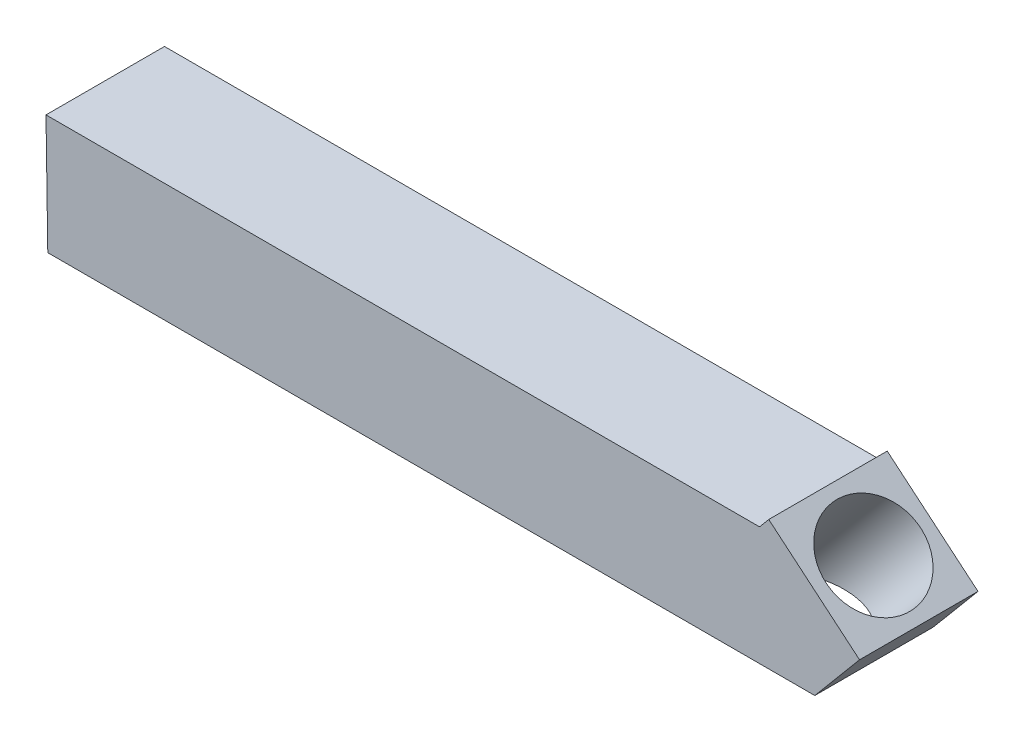
from build123d import *

# Parameters (mm, degrees)
BOSS_EXTRUDE1_DEPTH = 2.5
SKETCH2_R           = 1
CUT_EXTRUDE1_DEPTH  = 4.5
SKETCH3_R           = 1
CUT_EXTRUDE2_DEPTH  = 9.5
SKETCH5_R           = 1
BOSS_EXTRUDE2_DEPTH = 9.5


with BuildPart() as part:
    # Sketch1 → Boss-Extrude1 (new body)
    with BuildSketch(Plane.XY):
        Polygon((-70.406172668, -77.710060133), (-55.350496572, -77.710060133), (-55.155758053, -77.477979804), (-53.240646945, -79.084948828), (-54.184487309, -80.209773972), (-70.368347793, -80.209773972), align=None)
    extrude(amount=BOSS_EXTRUDE1_DEPTH)

    # Sketch2 → Cut-Extrude1 (cut)
    with BuildSketch(Plane(origin=(-60.939488189, -72.62485398, 0), x_dir=(0, 0, -1), z_dir=(0.6427876096865354, 0.7660444431189815, 0))):
        with Locations(Location((-1.25, -8.800123479, 0), (0, 0, 90))):
            Circle(SKETCH2_R)
    extrude(amount=-CUT_EXTRUDE1_DEPTH, mode=Mode.SUBTRACT)

    # Sketch3 → Cut-Extrude2 (cut)
    with BuildSketch(Plane(origin=(-71.565670343, -1.082908957, 0), x_dir=(0, 0, 1), z_dir=(-0.9998855357578961, -0.015129949839474953, 0))):
        with Locations(Location((1.25, -77.885923249, 0), (0, 0, 270))):
            Circle(SKETCH3_R)
    extrude(amount=-CUT_EXTRUDE2_DEPTH, mode=Mode.SUBTRACT)

    # Sketch5 → Boss-Extrude2 (add)
    with BuildSketch(Plane(origin=(-71.565670343, -1.082908957, 0), x_dir=(0, 0, 1), z_dir=(-0.9998855357578961, -0.015129949839476386, 0))):
        with Locations((1.25, -77.885923249)):
            Circle(SKETCH5_R)
    extrude(amount=-BOSS_EXTRUDE2_DEPTH)


solid = part.part
